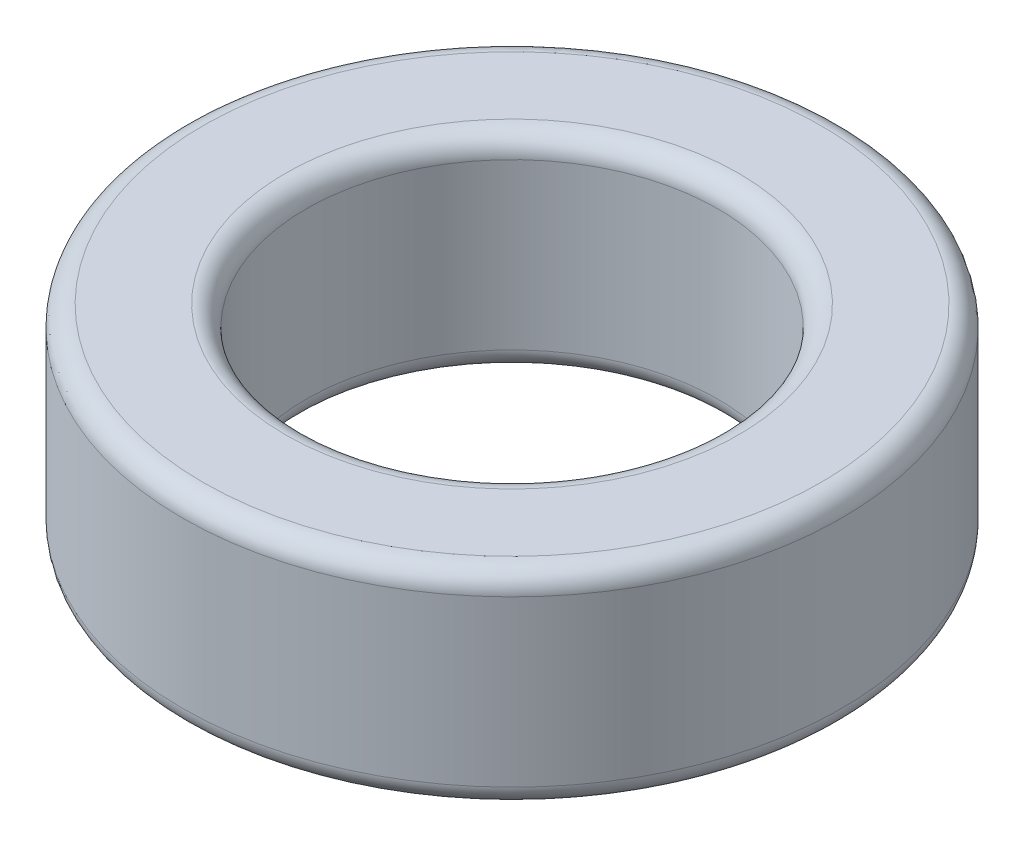
from build123d import *

# Parameters (mm, degrees)
SKETCH_1_R      = 8
SKETCH_1_R_2    = 5
EXTRUDE_1_DEPTH = 5
FILLET_1_R      = 0.5


with BuildPart() as part:
    # 草圖1 → 填料-伸長1 (new body)
    with BuildSketch(Plane(origin=(0, 0, 0), x_dir=(1, 0, 0), z_dir=(0, 1, 0))):
        with Locations(Location((0, 0, 0), (0, 0, 270))):
            Circle(SKETCH_1_R)
        with Locations(Location((0, 0, 0), (0, 0, 270))):
            Circle(SKETCH_1_R_2, mode=Mode.SUBTRACT)
    extrude(amount=EXTRUDE_1_DEPTH)

    # 圓角1
    fillet_1_edges = [part.edges().sort_by_distance(p)[0] for p in [
        (0, 0, -8),
        (0, 5, -8),
        (0, 0, -5),
        (0, 5, -5),
    ]]
    fillet(fillet_1_edges, radius=FILLET_1_R)


solid = part.part
